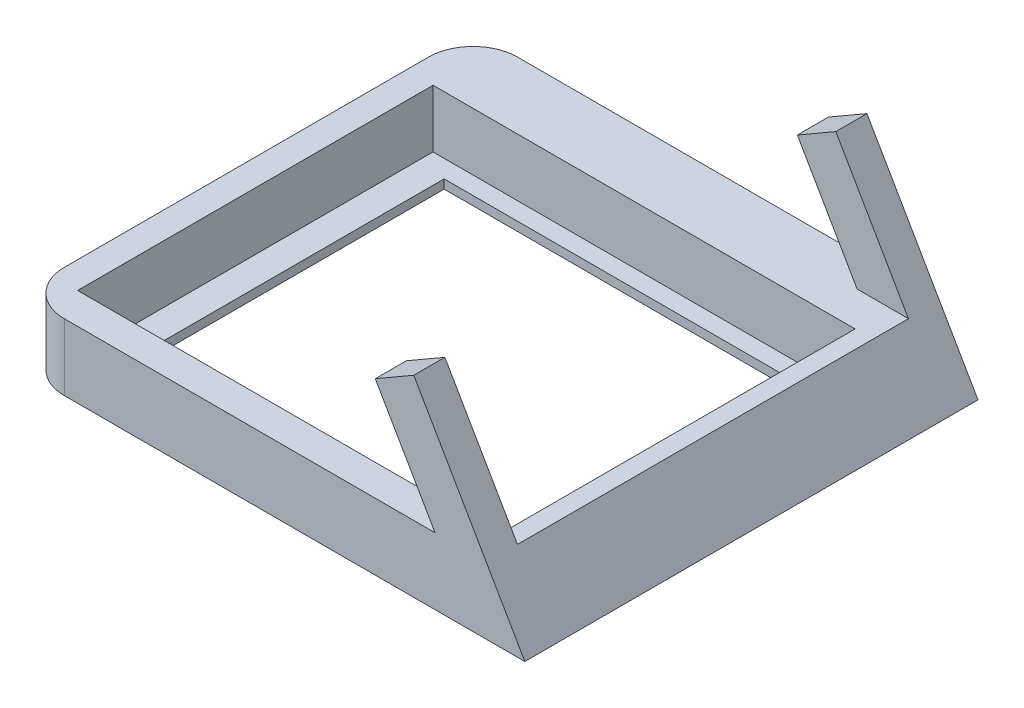
from build123d import *

# Parameters (mm, degrees)
SKIZZE6_W                        = 105
SKIZZE6_H                        = 90
AUFSATZ_LINEAR_AUSTRAGEN3_DEPTH  = 15
SKIZZE7_W                        = 98
SKIZZE7_H                        = 83
SCHNITT_LINEAR_AUSTRAGEN1_DEPTH  = 13
SKIZZE8_W                        = 93
SKIZZE8_H                        = 66
SCHNITT_LINEAR_AUSTRAGEN2_DEPTH  = 13
SKIZZE12_W                       = 83
SKIZZE12_H                       = 1
AUFSATZ_LINEAR_AUSTRAGEN4_DEPTH  = 2
SKIZZE13_W                       = 3
SKIZZE13_H                       = 80
SKIZZE13_H_2                     = 3
SKIZZE13_W_2                     = 95
AUFSATZ_LINEAR_AUSTRAGEN5_DEPTH  = 13
SKIZZE14_W                       = 105
SKIZZE14_H                       = 19
AUFSATZ_LINEAR_AUSTRAGEN7_DEPTH  = 2
SKIZZE15_W                       = 105
SKIZZE15_H                       = 12
AUFSATZ_LINEAR_AUSTRAGEN8_DEPTH  = 13
AUFSATZ_LINEAR_AUSTRAGEN13_DEPTH = 7
AUFSATZ_LINEAR_AUSTRAGEN14_DEPTH = 88
SKIZZE28_R                       = 1.25
SCHNITT_LINEAR_AUSTRAGEN3_DEPTH  = 2
VERRUNDUNG1_R                    = 10


with BuildPart() as part:
    # Skizze6 → Aufsatz-Linear austragen3 (new body)
    with BuildSketch(Plane(origin=(0, 0, 0), x_dir=(1, 0, 0), z_dir=(0, 1, 0))):
        with Locations((52.5, 45)):
            Rectangle(SKIZZE6_W, SKIZZE6_H)
    extrude(amount=AUFSATZ_LINEAR_AUSTRAGEN3_DEPTH)

    # Skizze7 → Schnitt-Linear austragen1 (cut)
    with BuildSketch(Plane(origin=(0, 15, 0), x_dir=(1, 0, 0), z_dir=(0, 1, 0))):
        with Locations((52, 45.5)):
            Rectangle(SKIZZE7_W, SKIZZE7_H)
    extrude(amount=-SCHNITT_LINEAR_AUSTRAGEN1_DEPTH, mode=Mode.SUBTRACT)

    # Skizze8 → Schnitt-Linear austragen2 (cut)
    with BuildSketch(Plane(origin=(0, 2, 0), x_dir=(1, 0, 0), z_dir=(0, 1, 0))):
        with Locations((52, 51)):
            Rectangle(SKIZZE8_W, SKIZZE8_H)
    extrude(amount=-SCHNITT_LINEAR_AUSTRAGEN2_DEPTH, mode=Mode.SUBTRACT)

    # Skizze12 → Aufsatz-Linear austragen4 (add)
    with BuildSketch(Plane.XZ):
        Polygon((5.5, -18), (5.5, -84), (12.5, -84), (12.5, -83), (12.5, -19), (12.5, -18), align=None)
        Polygon((95.5, -83), (95.5, -84), (98.5, -84), (98.5, -18), (95.5, -18), (95.5, -19), align=None)
        with Locations((54, -83.5)):
            Rectangle(SKIZZE12_W, SKIZZE12_H)
        with Locations((54, -18.5)):
            Rectangle(SKIZZE12_W, SKIZZE12_H)
    extrude(amount=-AUFSATZ_LINEAR_AUSTRAGEN4_DEPTH)

    # Skizze13 → Aufsatz-Linear austragen5 (add)
    with BuildSketch(Plane(origin=(0, 2, 0), x_dir=(1, 0, 0), z_dir=(0, 1, 0))):
        with Locations((4.5, 47)):
            Rectangle(SKIZZE13_W, SKIZZE13_H)
        with Locations((4.5, 5.5)):
            Rectangle(SKIZZE13_W, SKIZZE13_H_2)
        with Locations((53.5, 5.5)):
            Rectangle(SKIZZE13_W_2, SKIZZE13_H_2)
    extrude(amount=AUFSATZ_LINEAR_AUSTRAGEN5_DEPTH)

    # Skizze14 → Aufsatz-Linear austragen7 (add)
    with BuildSketch(Plane.XZ):
        with Locations((52.5, -92.5)):
            Rectangle(SKIZZE14_W, SKIZZE14_H)
    extrude(amount=-AUFSATZ_LINEAR_AUSTRAGEN7_DEPTH)

    # Skizze15 → Aufsatz-Linear austragen8 (add)
    with BuildSketch(Plane(origin=(0, 2, 0), x_dir=(1, 0, 0), z_dir=(0, 1, 0))):
        with Locations((52.5, 96)):
            Rectangle(SKIZZE15_W, SKIZZE15_H)
    extrude(amount=AUFSATZ_LINEAR_AUSTRAGEN8_DEPTH)

    # Skizze21 → Aufsatz-Linear austragen13 (add)
    with BuildSketch(Plane.XY):
        Polygon((113.660254038, 0), (105, 15), (88.660254038, 43.301270189), (80, 38.301270189), (102.113248654, 0), align=None)
    aufsatz_linear_austragen13 = extrude(amount=-AUFSATZ_LINEAR_AUSTRAGEN13_DEPTH)

    # Spiegeln2: Aufsatz-Linear austragen13 across plane
    add(aufsatz_linear_austragen13.mirror(Plane(origin=(0, 0, -51), x_dir=(1, 0, 0), z_dir=(0, 0, -1))))

    # Skizze22 → Aufsatz-Linear austragen14 (add)
    with BuildSketch(Plane(origin=(0, 0, -7), x_dir=(-1, 0, 0), z_dir=(0, 0, -1))):
        Polygon((-113.660254038, 0), (-105, 0), (-105, 15), align=None)
    extrude(amount=AUFSATZ_LINEAR_AUSTRAGEN14_DEPTH)

    # Skizze28 → Schnitt-Linear austragen3 (cut)
    with BuildSketch(Plane.XZ):
        with Locations(Location((11.322239977, -4.765490033, 0), (0, 0, 270))):
            Circle(SKIZZE28_R)
        with Locations(Location((31.667742372, -3.316351302, 0), (0, 0, 270))):
            Circle(SKIZZE28_R)
        with Locations(Location((64.25520832, -4.765490033, 0), (0, 0, 270))):
            Circle(SKIZZE28_R)
        with Locations(Location((95.104906067, -3.316351302, 0), (0, 0, 270))):
            Circle(SKIZZE28_R)
        with Locations(Location((95.104906067, -98.683648698, 0), (0, 0, 90))):
            Circle(SKIZZE28_R)
        with Locations(Location((64.25520832, -97.234509967, 0), (0, 0, 90))):
            Circle(SKIZZE28_R)
        with Locations(Location((31.667742372, -98.683648698, 0), (0, 0, 90))):
            Circle(SKIZZE28_R)
        with Locations(Location((11.322239977, -97.234509967, 0), (0, 0, 90))):
            Circle(SKIZZE28_R)
        with Locations(Location((108.821722726, -16.067904783, 0), (0, 0, 270))):
            Circle(SKIZZE28_R)
        with Locations(Location((108.821722726, -78.302664898, 0), (0, 0, 270))):
            Circle(SKIZZE28_R)
        with Locations(Location((110.246680606, -50.827682844, 0), (0, 0, 270))):
            Circle(SKIZZE28_R)
        with Locations(Location((2.746653242, -50.827682844, 0), (0, 0, 270))):
            Circle(SKIZZE28_R)
        with Locations(Location((3.570883833, -21.880288219, 0), (0, 0, 270))):
            Circle(SKIZZE28_R)
        with Locations(Location((3.186977763, -79.047966594, 0), (0, 0, 270))):
            Circle(SKIZZE28_R)
    extrude(amount=-SCHNITT_LINEAR_AUSTRAGEN3_DEPTH, mode=Mode.SUBTRACT)

    # Verrundung1
    verrundung1_edges = [part.edges().sort_by_distance(p)[0] for p in [
        (0, 7.5, -102),
        (0, 7.5, 0),
    ]]
    fillet(verrundung1_edges, radius=VERRUNDUNG1_R)


solid = part.part
